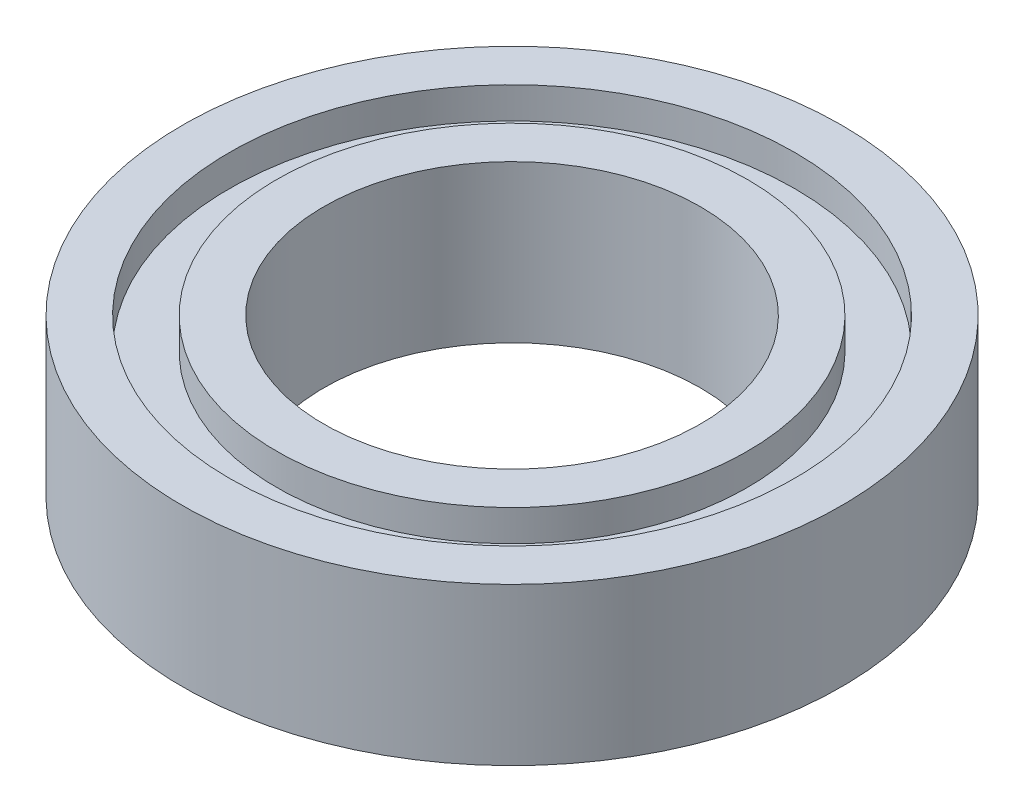
from build123d import *


with BuildPart() as part:
    # Croquis1 → Revolución1 (revolve)
    with BuildSketch(Plane.XY, mode=Mode.PRIVATE) as revoluci_n1_sk:
        Polygon((-6, 6.856705357), (-6, 11.856705357), (-7.5, 11.856705357), (-7.5, 10.856705357), (-9, 10.856705357), (-9, 11.856705357), (-10.5, 11.856705357), (-10.5, 6.856705357), (-9, 6.856705357), (-9, 7.856705357), (-7.5, 7.856705357), (-7.5, 6.856705357), align=None)
    revolve(revoluci_n1_sk.sketch.rotate(Axis((0, 0, 0), (0, 1, 0)), 270), axis=Axis((0, 0, 0), (0, 1, 0)))


solid = part.part
